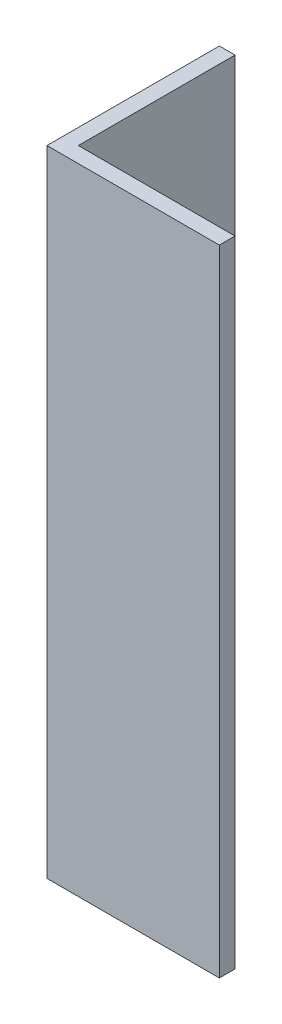
from build123d import *

# Parameters (mm, degrees)
EXTRUDE_1_DEPTH = 81


with BuildPart() as part:
    # Эскиз1 → Вытянуть1 (new body)
    with BuildSketch(Plane(origin=(0, 0, 0), x_dir=(1, 0, 0), z_dir=(0, 1, 0))):
        Polygon((0, -1.071873395), (0, -21.071873395), (20, -21.071873395), (20, -23.071873395), (-2, -23.071873395), (-2, -1.071873395), align=None)
    extrude(amount=EXTRUDE_1_DEPTH)


solid = part.part
